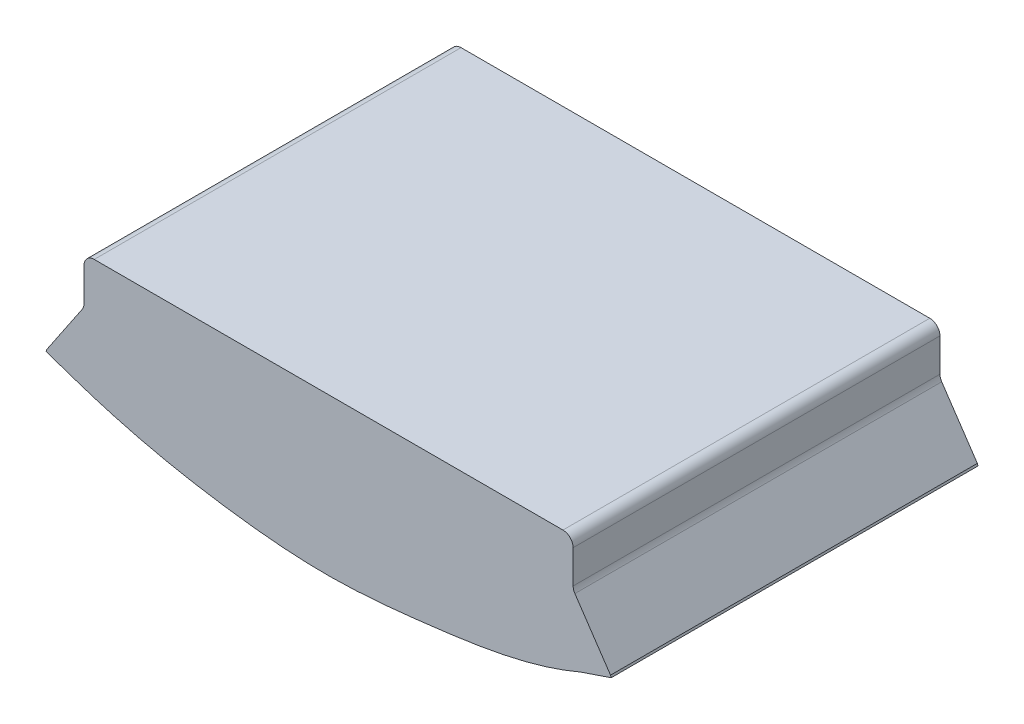
from build123d import *

# Parameters (mm, degrees)
BOSS_EXTRUDE1_DEPTH = 18


with BuildPart() as part:
    # Sketch1 → Boss-Extrude1 (new body)
    with BuildSketch(Plane.XY):
        with BuildLine():
            Line((35.376892046, -6.781044394), (36.866346672, -6.277070186))
            Line((36.866346672, -6.277070186), (36.834295551, -6.182345714))
            Line((36.834295551, -6.182345714), (35.085481214, -3.589621837))
            ThreePointArc((35.085481214, -3.589621837), (35.021847622, -3.456211238), (35, -3.310025385))
            Line((35, -3.310025385), (35, -1.682345714))
            ThreePointArc((35, -1.682345714), (34.853553391, -1.328792323), (34.5, -1.182345714))
            Line((34.5, -1.182345714), (11.5, -1.182345714))
            ThreePointArc((11.5, -1.182345714), (11.146446609, -1.328792323), (11, -1.682345714))
            Line((11, -1.682345714), (11, -3.310025385))
            ThreePointArc((11, -3.310025385), (10.978152378, -3.456211238), (10.914518786, -3.589621837))
            Line((10.914518786, -3.589621837), (9.165704449, -6.182345714))
            Line((9.165704449, -6.182345714), (9.133653328, -6.277070186))
            Line((9.133653328, -6.277070186), (10.607058659, -6.77561393))
            add(Edge.make_bspline(
                [(10.607058659, -6.77561393), (11.816063951, -7.18469486), (13.628034684, -7.692085525), (16.113891162, -8.202802822), (18.189551086, -8.532681309), (20.512287403, -8.80284347), (22.525873147, -8.895511296), (24.157727683, -8.851859587), (25.351258415, -8.774619539), (26.610405964, -8.65564999), (28.052887591, -8.489315058), (29.715436425, -8.277918045), (32.229421821, -7.855388776), (34.119164741, -7.321218718), (35.376892046, -6.781044394)],
                knots=[0, 0, 0, 0, 0.14631509, 0.222398937, 0.304823105, 0.398352424, 0.499675853, 0.544569926, 0.593205172, 0.641840418, 0.694528601, 0.764759844, 0.840843691, 1, 1, 1, 1], degree=3, weights=[1, 1, 1, 1, 1, 1, 1, 1, 1, 1, 1, 1, 1, 1, 1]))
        make_face()
    extrude(amount=-BOSS_EXTRUDE1_DEPTH)


solid = part.part
